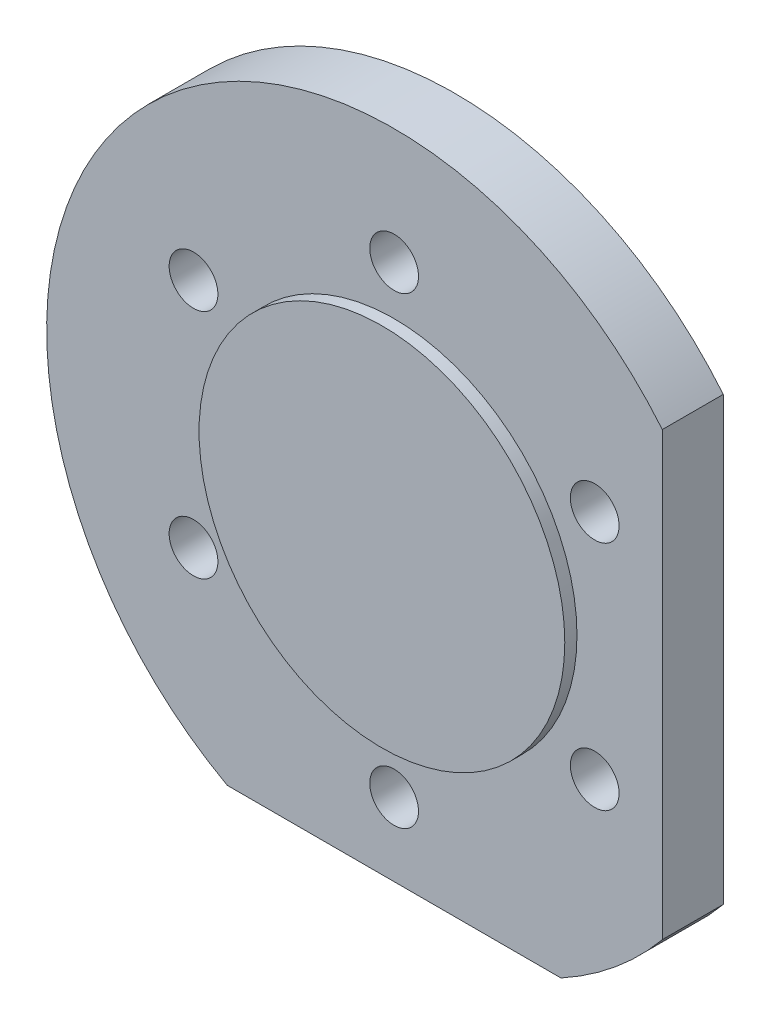
from build123d import *

# Parameters (mm, degrees)
SKETCH1_R           = 15
SKETCH1_R_2         = 2
BOSS_EXTRUDE1_DEPTH = 5
SKETCH1_2_R         = 15
BOSS_EXTRUDE2_DEPTH = 6
SKETCH2_R           = 12
SKETCH1_4_R         = 15


with BuildPart() as part:
    # Sketch1 → Boss-Extrude1 (new body)
    with BuildSketch(Plane.XY):
        with BuildLine():
            Line((22, -18.117670932), (22, 18.117670932))
            ThreePointArc((22, 18.117670932), (-21.956152501, 18.170783345), (-13.683932183, -25))
            Line((-13.683932183, -25), (13.683932183, -25))
            ThreePointArc((13.683932183, -25), (18.170783345, -21.956152501), (22, -18.117670932))
        make_face()
        Circle(SKETCH1_R, mode=Mode.SUBTRACT)
        with Locations((0, 19)):
            Circle(SKETCH1_R_2, mode=Mode.SUBTRACT)
        with Locations((16.454482672, 9.5)):
            Circle(SKETCH1_R_2, mode=Mode.SUBTRACT)
        with Locations((16.454482672, -9.5)):
            Circle(SKETCH1_R_2, mode=Mode.SUBTRACT)
        with Locations((0, -19)):
            Circle(SKETCH1_R_2, mode=Mode.SUBTRACT)
        with Locations((-16.454482672, -9.5)):
            Circle(SKETCH1_R_2, mode=Mode.SUBTRACT)
        with Locations((-16.454482672, 9.5)):
            Circle(SKETCH1_R_2, mode=Mode.SUBTRACT)
    extrude(amount=BOSS_EXTRUDE1_DEPTH)

    # Sketch1<2> → Boss-Extrude2 (add)
    with BuildSketch(Plane.XY):
        Circle(SKETCH1_2_R)
    extrude(amount=BOSS_EXTRUDE2_DEPTH)

    # Sketch2 → Loft1 section 0
    with BuildSketch(Plane.XY.offset(-7)):
        Circle(SKETCH2_R)
    # Sketch1<4> → Loft1 section 1
    with BuildSketch(Plane.XY):
        Circle(SKETCH1_4_R)
    loft()


solid = part.part
